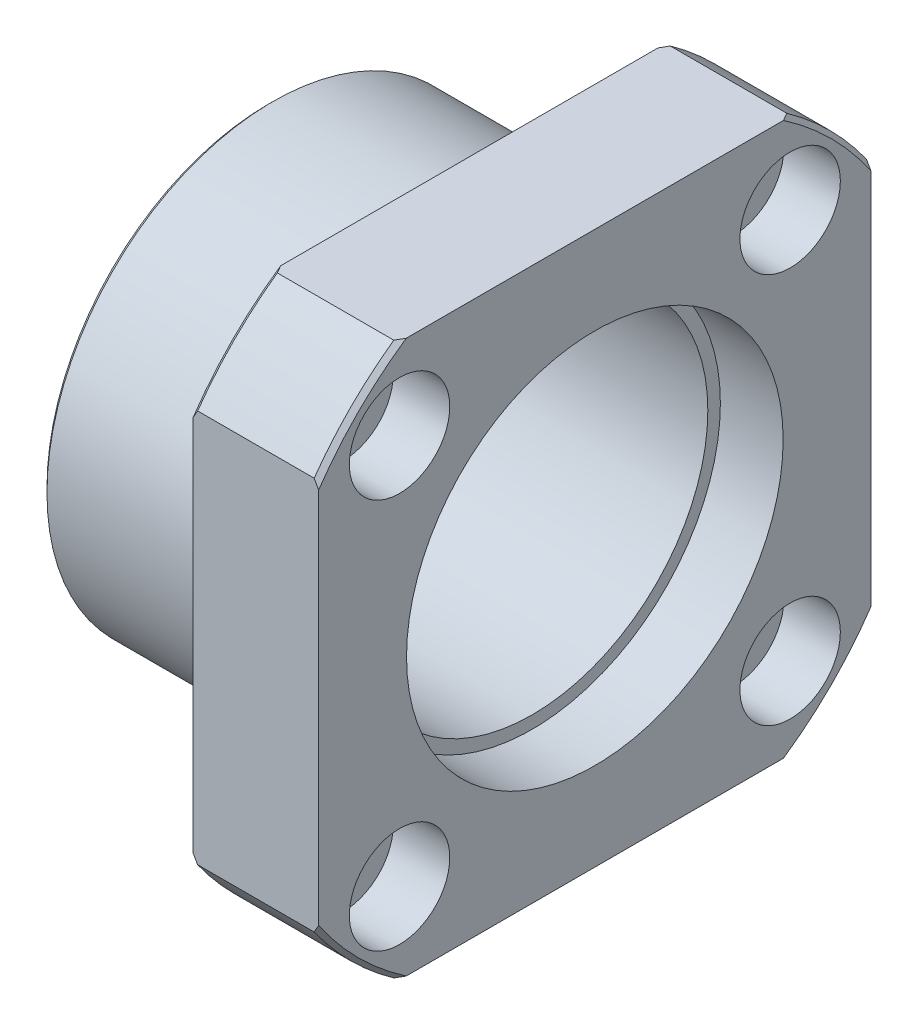
from build123d import *

# Parameters (mm, degrees)
BOSS_EXTRUDE1_DEPTH                              = 10
SKETCH2_W                                        = 16
SKETCH2_H                                        = 18
CBORE_FOR_M4_HEX_HEAD_MACHINE_SCREW1_D           = 4.5
CBORE_FOR_M4_HEX_HEAD_MACHINE_SCREW1_DEPTH       = 26
CBORE_FOR_M4_HEX_HEAD_MACHINE_SCREW1_CBORE_D     = 8
CBORE_FOR_M4_HEX_HEAD_MACHINE_SCREW1_CBORE_DEPTH = 4.5
CHAMFER1_SIZE                                    = 0.36
FILLET1_R                                        = 0.3


with BuildPart() as part:
    # Sketch1 → Boss-Extrude1 (new body)
    with BuildSketch(Plane(origin=(16, 0, 0), x_dir=(0, -1, 0), z_dir=(-1, 0, 0))):
        with BuildLine():
            Line((15.652475842, 22), (-15.652475842, 22))
            ThreePointArc((-15.652475842, 22), (-19.091883092, 19.091883092), (-22, 15.652475842))
            Line((-22, 15.652475842), (-22, -15.652475842))
            ThreePointArc((-22, -15.652475842), (-19.091883092, -19.091883092), (-15.652475842, -22))
            Line((-15.652475842, -22), (15.652475842, -22))
            ThreePointArc((15.652475842, -22), (19.091883092, -19.091883092), (22, -15.652475842))
            Line((22, -15.652475842), (22, 15.652475842))
            ThreePointArc((22, 15.652475842), (19.091883092, 19.091883092), (15.652475842, 22))
        make_face()
    extrude(amount=-BOSS_EXTRUDE1_DEPTH)

    # Sketch2 → Revolve1 (revolve)
    with BuildSketch(Plane.XY, mode=Mode.PRIVATE) as revolve1_sk:
        with Locations((8, 9)):
            Rectangle(SKETCH2_W, SKETCH2_H)
    revolve(revolve1_sk.sketch.rotate(Axis((0, 0, 0), (1, 0, 0)), 270), axis=Axis((0, 0, 0), (1, 0, 0)))

    # Sketch3 → Cut-Revolve1 (revolve, cut)
    with BuildSketch(Plane.XY, mode=Mode.PRIVATE) as cut_revolve1_sk:
        Polygon((0, 7.75), (0, 0), (26, 0), (26, 15), (21, 15), (21, 14), (5, 14), (5, 7.75), align=None)
    revolve(cut_revolve1_sk.sketch.rotate(Axis((0, 0, 0), (1, 0, 0)), 270), axis=Axis((0, 0, 0), (1, 0, 0)), mode=Mode.SUBTRACT)

    # CBORE for M4 Hex Head Machine Screw1
    with Locations(Plane(origin=(26, 0, 0), x_dir=(0, 0, -1), z_dir=(1, 0, 0))):
        with Locations((-15.556349186, -15.556349186), (15.556349186, 15.556349186), (15.556349186, -15.556349186), (-15.556349186, 15.556349186)):
            CounterBoreHole(CBORE_FOR_M4_HEX_HEAD_MACHINE_SCREW1_D / 2, CBORE_FOR_M4_HEX_HEAD_MACHINE_SCREW1_CBORE_D / 2, CBORE_FOR_M4_HEX_HEAD_MACHINE_SCREW1_CBORE_DEPTH, depth=CBORE_FOR_M4_HEX_HEAD_MACHINE_SCREW1_DEPTH)

    # Chamfer1
    chamfer1_edges = [part.edges().sort_by_distance(p)[0] for p in [
        (26, 19.091883092, 19.091883092),
        (16, -19.091883092, 19.091883092),
        (26, 19.091883092, -19.091883092),
        (26, -19.091883092, -19.091883092),
        (0, 0, 18),
        (26, -19.091883092, 19.091883092),
        (16, -19.091883092, -19.091883092),
        (16, 19.091883092, -19.091883092),
        (16, 19.091883092, 19.091883092),
    ]]
    chamfer(chamfer1_edges, length=CHAMFER1_SIZE)

    # Fillet1
    fillet1_edges = [part.edges().sort_by_distance(p)[0] for p in [
        (16, 0, 18),
    ]]
    fillet(fillet1_edges, radius=FILLET1_R)


solid = part.part
